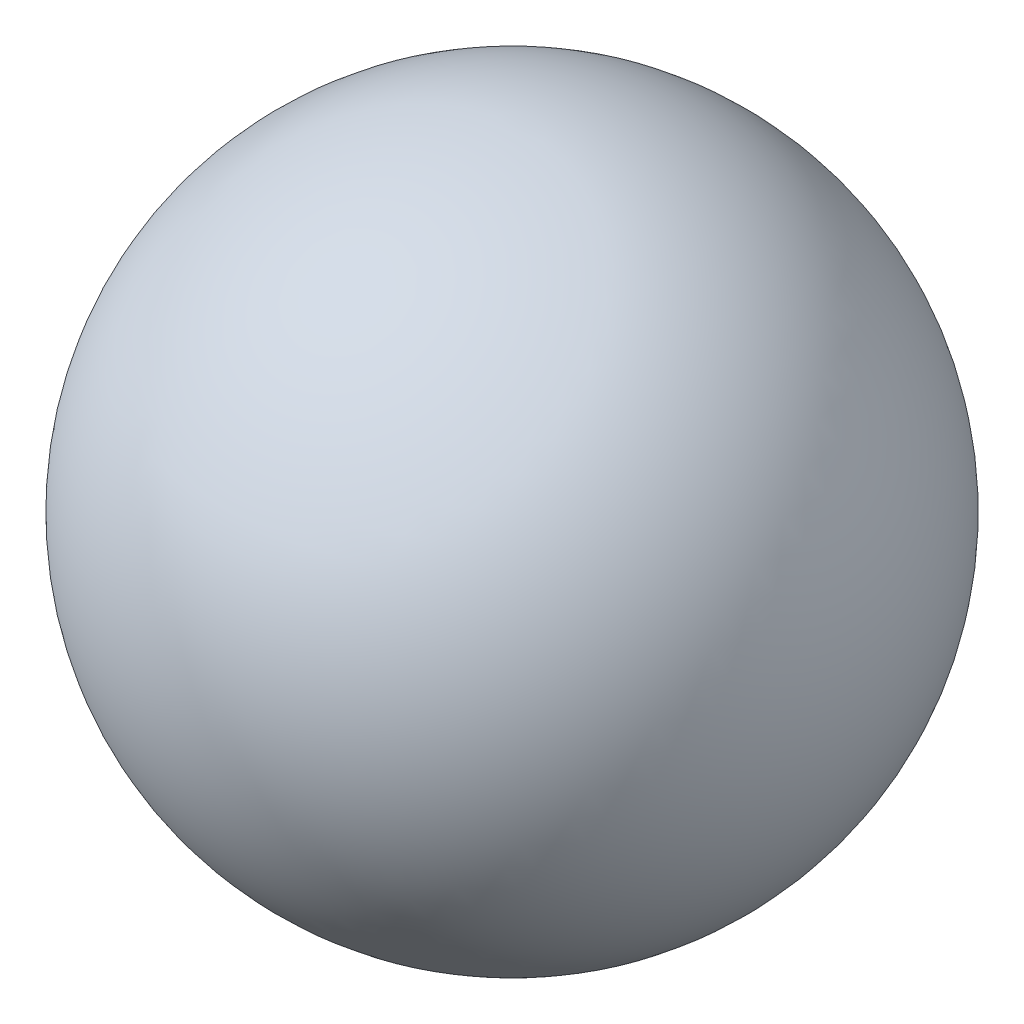
from build123d import *


with BuildPart() as part:
    # Sketch1 → Revolve1 (revolve)
    with BuildSketch(Plane.XY):
        with BuildLine():
            Line((0, 37), (0, 36))
            ThreePointArc((0, 36), (36, 0), (0, -36))
            Line((0, -36), (0, -37))
            ThreePointArc((0, -37), (37, 0), (0, 37))
        make_face()
    revolve(axis=Axis((0, 37, 0), (0, -1, 0)))


solid = part.part
